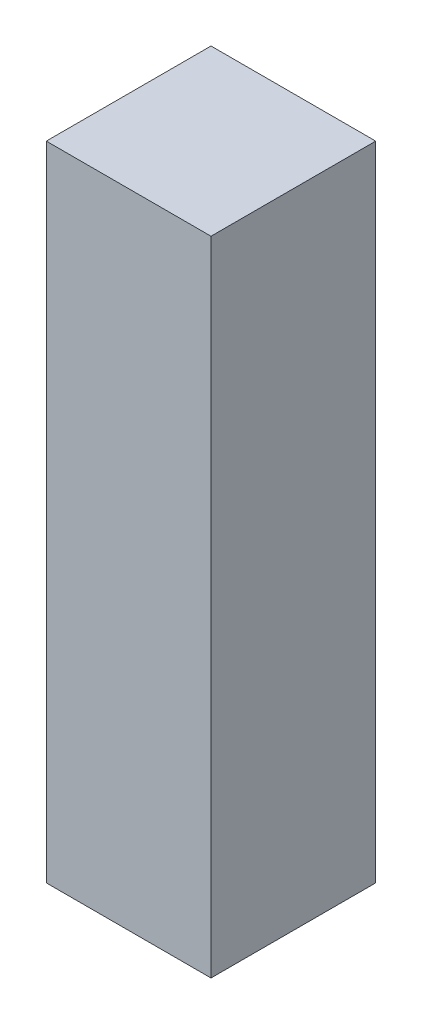
from build123d import *

# Parameters (mm, degrees)
SK_P01_MICROFIT3024POSMATED_W  = 10
SK_P01_MICROFIT3024POSMATED_H  = 10
P01_MICROFIT3024POSMATED_DEPTH = 39


with BuildPart() as part:
    # SK_P01_MicroFit3024posmated → P01_MicroFit3024posmated (new body)
    with BuildSketch(Plane(origin=(0, 0, 0), x_dir=(1, 0, 0), z_dir=(0, 1, 0))):
        Rectangle(SK_P01_MICROFIT3024POSMATED_W, SK_P01_MICROFIT3024POSMATED_H)
    extrude(amount=P01_MICROFIT3024POSMATED_DEPTH)


solid = part.part
